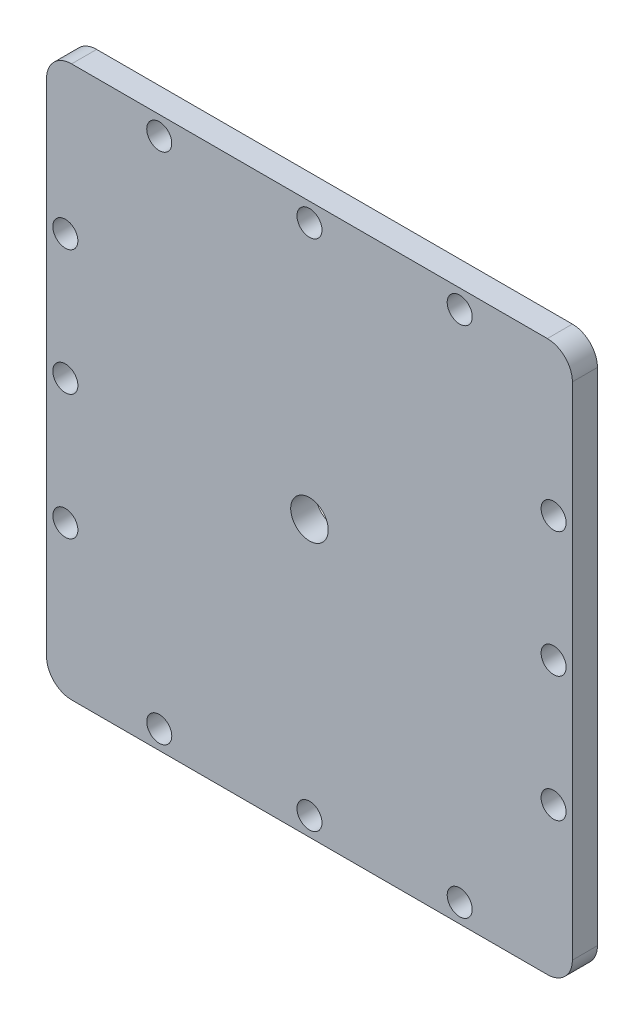
from build123d import *

# Parameters (mm, degrees)
SKETCH_1_R          = 5
EXTRUDE_1_DEPTH     = 10
SKETCH_2_R          = 7.5
CUT_EXTRUDE_1_DEPTH = 153.397506541


with BuildPart() as part:
    # 草图1 → 凸台-拉伸1 (new body)
    with BuildSketch(Plane.XY):
        with BuildLine():
            Line((-95, -110), (95, -110))
            ThreePointArc((95, -110), (102.071067812, -107.071067812), (105, -100))
            Line((105, -100), (105, 100))
            ThreePointArc((105, 100), (102.071067812, 107.071067812), (95, 110))
            Line((95, 110), (-95, 110))
            ThreePointArc((-95, 110), (-102.071067812, 107.071067812), (-105, 100))
            Line((-105, 100), (-105, -100))
            ThreePointArc((-105, -100), (-102.071067812, -107.071067812), (-95, -110))
        make_face()
        with Locations((97.5, 0)):
            Circle(SKETCH_1_R, mode=Mode.SUBTRACT)
        with Locations((0, 102.5)):
            Circle(SKETCH_1_R, mode=Mode.SUBTRACT)
        with Locations((60, 102.5)):
            Circle(SKETCH_1_R, mode=Mode.SUBTRACT)
        with Locations((97.5, 50)):
            Circle(SKETCH_1_R, mode=Mode.SUBTRACT)
        with Locations(Location((97.5, -50, 0), (0, 0, 180))):
            Circle(SKETCH_1_R, mode=Mode.SUBTRACT)
        with Locations(Location((60, -102.5, 0), (0, 0, 180))):
            Circle(SKETCH_1_R, mode=Mode.SUBTRACT)
        with Locations(Location((0, -102.5, 0), (0, 0, 180))):
            Circle(SKETCH_1_R, mode=Mode.SUBTRACT)
        with Locations(Location((-60, 102.5, 0), (0, 0, 180))):
            Circle(SKETCH_1_R, mode=Mode.SUBTRACT)
        with Locations((-60, -102.5)):
            Circle(SKETCH_1_R, mode=Mode.SUBTRACT)
        with Locations((-97.5, -50)):
            Circle(SKETCH_1_R, mode=Mode.SUBTRACT)
        with Locations(Location((-97.5, 0, 0), (0, 0, 180))):
            Circle(SKETCH_1_R, mode=Mode.SUBTRACT)
        with Locations(Location((-97.5, 50, 0), (0, 0, 180))):
            Circle(SKETCH_1_R, mode=Mode.SUBTRACT)
    extrude(amount=EXTRUDE_1_DEPTH)

    # 草图2 → 切除-拉伸1 (cut, through all)
    with BuildSketch(Plane.XY.offset(10)):
        Circle(SKETCH_2_R)
    extrude(amount=-CUT_EXTRUDE_1_DEPTH, mode=Mode.SUBTRACT)


solid = part.part
